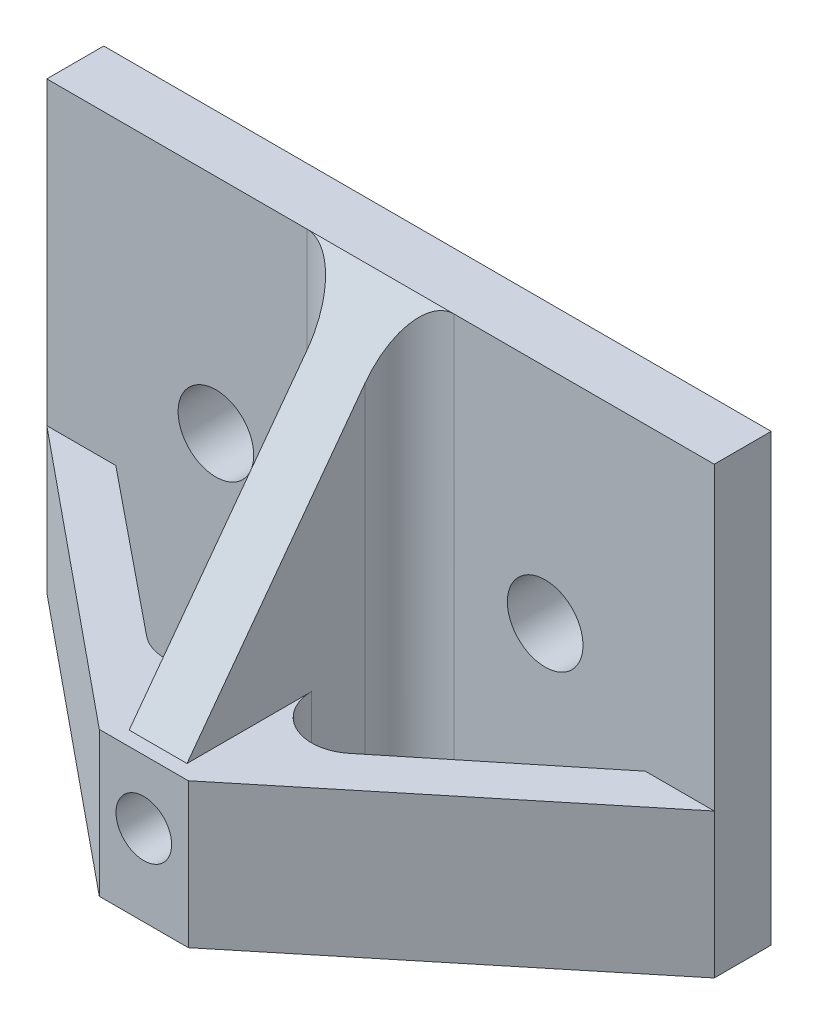
from build123d import *

# Parameters (mm, degrees)
SKETCH1_W               = 38.1
SKETCH1_H               = 16.764
BOSS_EXTRUDE1_DEPTH     = 25.4
CUT_EXTRUDE1_DEPTH      = 33.837789572
CUT_EXTRUDE3_DEPTH      = 33.837789572
CUT_EXTRUDE4_DEPTH      = 17.145
SKETCH7_R               = 2.159
CUT_EXTRUDE5_DEPTH      = 36.903957943
CUT_EXTRUDE6_DEPTH      = 34.822319923
CUT_EXTRUDE6_DEPTH_BACK = 34.822319923
SKETCH10_R              = 1.5875
CUT_EXTRUDE7_DEPTH      = 9.398


with BuildPart() as part:
    # Sketch1 → Boss-Extrude1 (new body)
    with BuildSketch(Plane(origin=(0, 0, 0), x_dir=(1, 0, 0), z_dir=(0, 1, 0))):
        Rectangle(SKETCH1_W, SKETCH1_H)
    extrude(amount=BOSS_EXTRUDE1_DEPTH)

    # Sketch3 → Cut-Extrude1 (cut, through all)
    with BuildSketch(Plane.XZ):
        Polygon((-2.54, 8.382), (-19.05, -5.132614164), (-19.05, 8.382), align=None)
        Polygon((19.05, -5.132614164), (19.05, 8.382), (2.54, 8.382), align=None)
    extrude(amount=-CUT_EXTRUDE1_DEPTH, mode=Mode.SUBTRACT)

    # Sketch5 → Cut-Extrude3 (cut, through all)
    with BuildSketch(Plane.XZ):
        with BuildLine():
            Line((-4.191, -5.132614164), (-15.113, -5.132614164))
            Line((-15.113, -5.132614164), (-5.790995153, 2.428103634))
            ThreePointArc((-5.790995153, 2.428103634), (-3.098385632, 2.748373809), (-1.651, 0.455385836))
            Line((-1.651, 0.455385836), (-1.651, -2.592614164))
            ThreePointArc((-1.651, -2.592614164), (-2.394948776, -4.388665388), (-4.191, -5.132614164))
        make_face()
        with BuildLine():
            Line((1.651, 0.455385836), (1.651, -2.592614164))
            ThreePointArc((1.651, -2.592614164), (2.394948776, -4.388665388), (4.191, -5.132614164))
            Line((4.191, -5.132614164), (15.113, -5.132614164))
            Line((15.113, -5.132614164), (5.790995153, 2.428103634))
            ThreePointArc((5.790995153, 2.428103634), (3.098385632, 2.748373809), (1.651, 0.455385836))
        make_face()
    extrude(amount=-CUT_EXTRUDE3_DEPTH, mode=Mode.SUBTRACT)

    # Sketch6 → Cut-Extrude4 (cut)
    with BuildSketch(Plane(origin=(0, 25.4, 0), x_dir=(1, 0, 0), z_dir=(0, 1, 0))):
        Polygon((1.651, -0.455385836), (1.651, -11.682968512), (19.05, 5.132614164), (4.191, 5.132614164), align=None)
        Polygon((-4.191, 5.132614164), (-1.651, -0.455385836), (-1.651, -11.682968512), (-19.05, 5.132614164), align=None)
    extrude(amount=-CUT_EXTRUDE4_DEPTH, mode=Mode.SUBTRACT)

    # Sketch7 → Cut-Extrude5 (cut, through all)
    with BuildSketch(Plane(origin=(0, 0, -8.382), x_dir=(-1, 0, 0), z_dir=(0, 0, -1))):
        with Locations((-9.398, 12.7)):
            Circle(SKETCH7_R)
        with Locations((9.398, 12.7)):
            Circle(SKETCH7_R)
    extrude(amount=-CUT_EXTRUDE5_DEPTH, mode=Mode.SUBTRACT)

    # Sketch9 → Cut-Extrude6 (cut, two sides: drawn at the far end of the back side and taken through both)
    with BuildSketch(Plane(origin=(1.651, 0, 0), x_dir=(0, 0, -1), z_dir=(1, 0, 0)).offset(-CUT_EXTRUDE6_DEPTH_BACK)):
        Polygon((5.132614164, 25.4), (-7.56675082, 8.255), (-10.075287768, 8.255), (-10.075287768, 25.4), (-7.56675082, 25.4), align=None)
    extrude(amount=CUT_EXTRUDE6_DEPTH + CUT_EXTRUDE6_DEPTH_BACK, mode=Mode.SUBTRACT)

    # Sketch10 → Cut-Extrude7 (cut)
    with BuildSketch(Plane.XY.offset(8.382)):
        with Locations((0, 4.623103893)):
            Circle(SKETCH10_R)
    extrude(amount=-CUT_EXTRUDE7_DEPTH, mode=Mode.SUBTRACT)


solid = part.part
